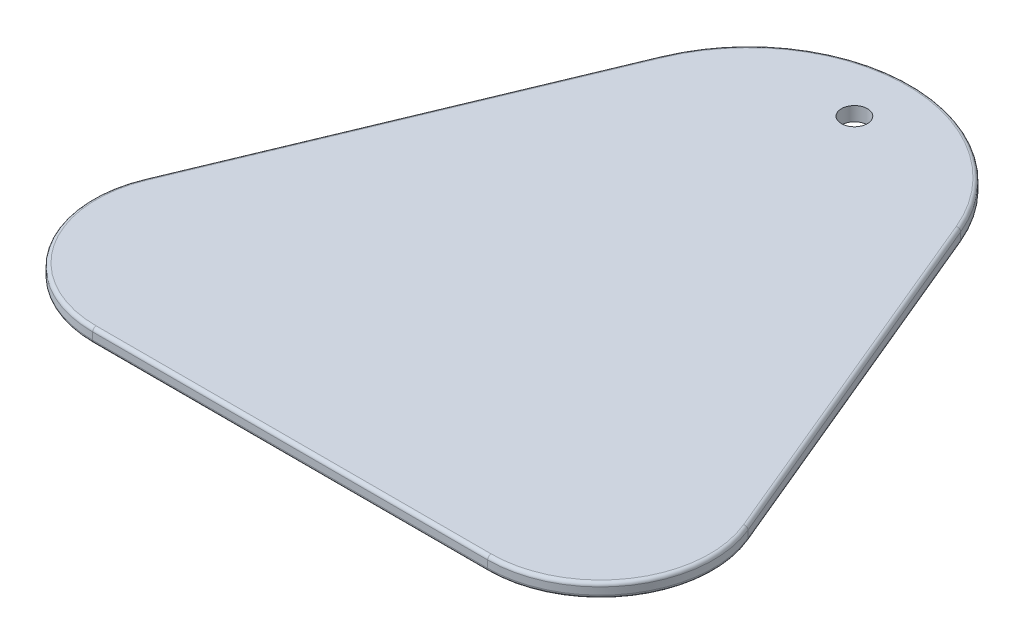
from build123d import *

# Parameters (mm, degrees)
SKETCH1_R           = 11.7094
BOSS_EXTRUDE1_DEPTH = 12.7
FILLET2_R           = 3.175
FILLET3_R           = 3.175


with BuildPart() as part:
    # Sketch1 → Boss-Extrude1 (new body)
    with BuildSketch(Plane(origin=(0, 0, 0), x_dir=(1, 0, 0), z_dir=(0, 1, 0))):
        with BuildLine():
            Line((134.815384615, 367.323076923), (271.584615385, 39.076923077))
            ThreePointArc((271.584615385, 39.076923077), (262.336309905, -56.357539936), (177.8, -101.6))
            Line((177.8, -101.6), (-177.8, -101.6))
            ThreePointArc((-177.8, -101.6), (-262.336309905, -56.357539936), (-271.584615385, 39.076923077))
            Line((-271.584615385, 39.076923077), (-134.815384615, 367.323076923))
            ThreePointArc((-134.815384615, 367.323076923), (0, 457.2), (134.815384615, 367.323076923))
        make_face()
        with Locations(Location((0, 406.4, 0), (0, 0, 270))):
            Circle(SKETCH1_R, mode=Mode.SUBTRACT)
    extrude(amount=BOSS_EXTRUDE1_DEPTH)

    # Fillet2
    fillet2_edges = [part.edges().sort_by_distance(p)[0] for p in [
        (-262.336309905, 12.7, 56.357539936),
        (0, 12.7, 101.6),
        (262.336309905, 12.7, 56.357539936),
        (203.2, 12.7, -203.2),
        (0, 12.7, -457.2),
        (-203.2, 12.7, -203.2),
    ]]
    fillet(fillet2_edges, radius=FILLET2_R)

    # Fillet3
    fillet3_edges = [part.edges().sort_by_distance(p)[0] for p in [
        (203.2, 0, -203.2),
        (262.336309905, 0, 56.357539936),
        (0, 0, 101.6),
        (-262.336309905, 0, 56.357539936),
        (-203.2, 0, -203.2),
        (0, 0, -457.2),
    ]]
    fillet(fillet3_edges, radius=FILLET3_R)


solid = part.part
